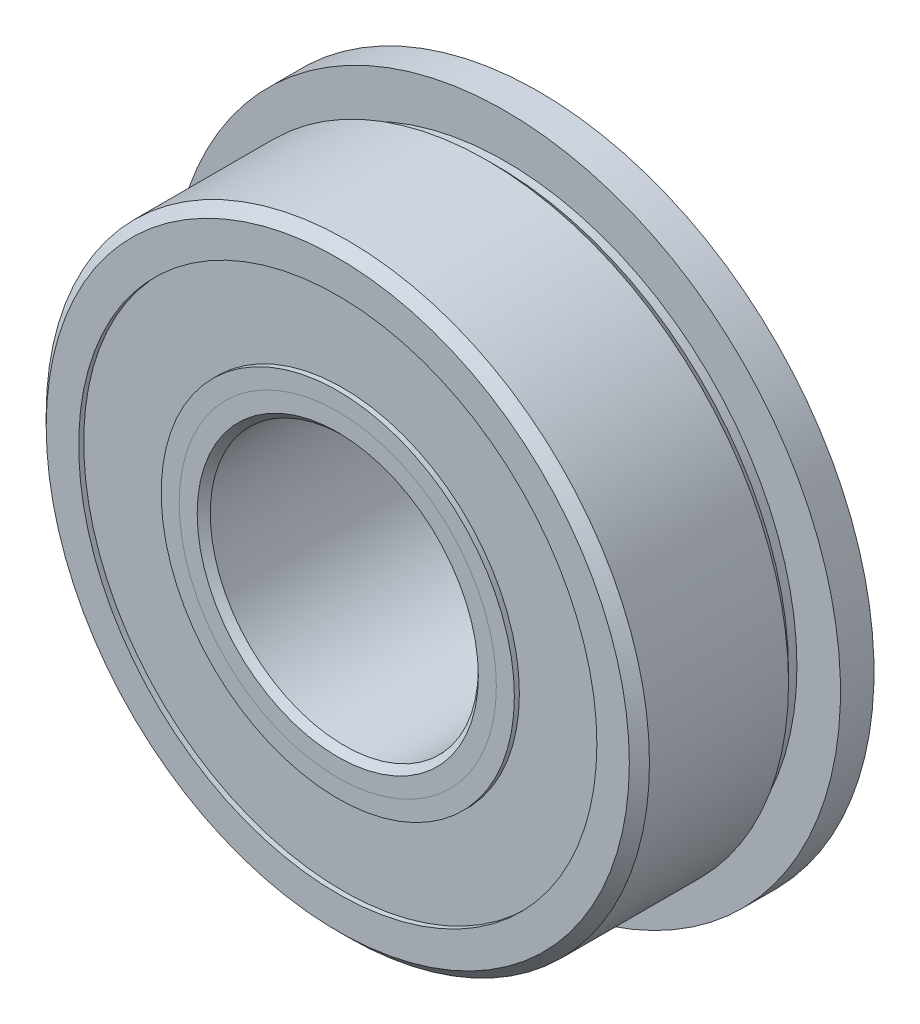
from build123d import *

# Parameters (mm, degrees)
SKETCH5_W          = 1.5875
SKETCH5_H          = 2.833076923
CIRPATTERN1_COUNT  = 12
SKETCH7_W          = 1.174197652
SKETCH7_H          = 3.907692308
SKETCH7_H_2        = 3.534996154
SKETCH9_R          = 7.956677
SKETCH9_R_2        = 7.607173
CUT_EXTRUDE1_DEPTH = 0.127
SKETCH10_R         = 9.436608
SKETCH10_R_2       = 8.7376
CUT_EXTRUDE2_DEPTH = 0.254


with BuildPart() as part:
    # Sketch8 → Revolve7 (revolve)
    with BuildSketch(Plane(origin=(0, 0, 0), x_dir=(0, 0, -1), z_dir=(1, 0, 0)), mode=Mode.PRIVATE) as revolve7_sk:
        with BuildLine():
            ThreePointArc((2.721428571, 12.272596154), (0, 13.668927348), (-2.721428571, 12.272596154))
            Line((-2.721428571, 12.272596154), (-4.7625, 12.272596154))
            Line((-4.7625, 12.272596154), (-4.7625, 13.81125))
            Line((-4.7625, 13.81125), (-4.28625, 14.2875))
            Line((-4.28625, 14.2875), (4.28625, 14.2875))
            Line((4.28625, 14.2875), (4.7625, 13.81125))
            Line((4.7625, 13.81125), (4.7625, 12.272596154))
            Line((4.7625, 12.272596154), (2.721428571, 12.272596154))
        make_face()
    revolve(revolve7_sk.sketch.rotate(Axis((0, 0, 4.7625), (0, 0, -1)), 90), axis=Axis((0, 0, 4.7625), (0, 0, -1)))

    # Sketch5 → Revolve5 (revolve)
    with BuildSketch(Plane(origin=(0, 0, 0), x_dir=(0, 0, -1), z_dir=(1, 0, 0)), mode=Mode.PRIVATE) as revolve5_sk:
        with Locations((3.96875, 14.458461539)):
            Rectangle(SKETCH5_W, SKETCH5_H)
    revolve(revolve5_sk.sketch.rotate(Axis((0, 0, -6.35), (0, 0, 1)), 270), axis=Axis((0, 0, -6.35), (0, 0, 1)))

    # Sketch6 → Cut-Revolve1 (revolve, cut)
    with BuildSketch(Plane(origin=(0, 0, 0), x_dir=(0, 0, -1), z_dir=(1, 0, 0)), mode=Mode.PRIVATE) as cut_revolve1_sk:
        Polygon((2.301875, 14.2875), (2.778125, 13.81125), (3.175, 13.81125), (3.175, 14.2875), align=None)
    revolve(cut_revolve1_sk.sketch.rotate(Axis((0, 0, 4.7625), (0, 0, -1)), 90), axis=Axis((0, 0, 4.7625), (0, 0, -1)), mode=Mode.SUBTRACT)


with BuildPart() as body_2:
    # Sketch2 → Revolve2 (revolve)
    with BuildSketch(Plane(origin=(0, 0, 0), x_dir=(0, 0, -1), z_dir=(1, 0, 0)), mode=Mode.PRIVATE) as revolve2_sk:
        with BuildLine():
            Line((-4.7625, 8.364903846), (-2.721428571, 8.364903846))
            ThreePointArc((-2.721428571, 8.364903846), (-1.529371952, 7.338026985), (0, 6.968572652))
            Line((0, 6.968572652), (0, 6.659286326))
            Line((0, 6.659286326), (-3.90969124, 6.659286326))
            Line((-3.90969124, 6.659286326), (-4.7625, 7.512095086))
            Line((-4.7625, 7.512095086), (-4.7625, 8.364903846))
        make_face()
    revolve(revolve2_sk.sketch.rotate(Axis((0, 0, 4.7625), (0, 0, -1)), 90), axis=Axis((0, 0, 4.7625), (0, 0, -1)))


with BuildPart() as body_3:
    # Sketch3 → Revolve3 (revolve)
    with BuildSketch(Plane(origin=(0, 0, 0), x_dir=(0, 0, -1), z_dir=(1, 0, 0)), mode=Mode.PRIVATE) as revolve3_sk:
        with BuildLine():
            Line((-4.7625, 7.512095086), (-3.90969124, 6.659286326))
            Line((-3.90969124, 6.659286326), (0, 6.659286326))
            Line((0, 6.659286326), (0, 6.968572652))
            ThreePointArc((0, 6.968572652), (1.721417345, 7.444656997), (2.953583068, 8.7376))
            Line((2.953583068, 8.7376), (6.35, 8.7376))
            Line((6.35, 8.7376), (6.35, 6.82625))
            Line((6.35, 6.82625), (5.87375, 6.35))
            Line((5.87375, 6.35), (-4.453213674, 6.35))
            Line((-4.453213674, 6.35), (-4.7625, 6.659286326))
            Line((-4.7625, 6.659286326), (-4.7625, 7.512095086))
        make_face()
    revolve(revolve3_sk.sketch.rotate(Axis((0, 0, 4.7625), (0, 0, -1)), 90), axis=Axis((0, 0, 4.7625), (0, 0, -1)))

    # Sketch9 → Cut-Extrude1 (cut)
    with BuildSketch(Plane(origin=(0, 0, -6.35), x_dir=(-1, 0, 0), z_dir=(0, 0, -1))):
        Circle(SKETCH9_R)
        Circle(SKETCH9_R_2, mode=Mode.SUBTRACT)
    extrude(amount=-CUT_EXTRUDE1_DEPTH, mode=Mode.SUBTRACT)


with BuildPart() as body_4:
    # Sketch4 → Revolve4 (revolve)
    with BuildSketch(Plane(origin=(0, 0, 0), x_dir=(0, 0, -1), z_dir=(1, 0, 0))):
        with BuildLine():
            Line((-3.350177348, 10.31875), (3.350177348, 10.31875))
            ThreePointArc((3.350177348, 10.31875), (0, 13.668927348), (-3.350177348, 10.31875))
        make_face()
    revolve(axis=Axis((0, 10.31875, 3.350177348), (0, 0, -1)))


with BuildPart() as cirpattern1_1:
    # CirPattern1: pattern copy
    add(body_4.part.rotate(Axis((0, 0, 0), (0, 0, 1)), 1 * 360 / CIRPATTERN1_COUNT))


with BuildPart() as cirpattern1_2:
    # CirPattern1: pattern copy
    add(body_4.part.rotate(Axis((0, 0, 0), (0, 0, 1)), 2 * 360 / CIRPATTERN1_COUNT))


with BuildPart() as cirpattern1_3:
    # CirPattern1: pattern copy
    add(body_4.part.rotate(Axis((0, 0, 0), (0, 0, 1)), 3 * 360 / CIRPATTERN1_COUNT))


with BuildPart() as cirpattern1_4:
    # CirPattern1: pattern copy
    add(body_4.part.rotate(Axis((0, 0, 0), (0, 0, 1)), 4 * 360 / CIRPATTERN1_COUNT))


with BuildPart() as cirpattern1_5:
    # CirPattern1: pattern copy
    add(body_4.part.rotate(Axis((0, 0, 0), (0, 0, 1)), 5 * 360 / CIRPATTERN1_COUNT))


with BuildPart() as cirpattern1_6:
    # CirPattern1: pattern copy
    add(body_4.part.rotate(Axis((0, 0, 0), (0, 0, 1)), 6 * 360 / CIRPATTERN1_COUNT))


with BuildPart() as cirpattern1_7:
    # CirPattern1: pattern copy
    add(body_4.part.rotate(Axis((0, 0, 0), (0, 0, 1)), 7 * 360 / CIRPATTERN1_COUNT))


with BuildPart() as cirpattern1_8:
    # CirPattern1: pattern copy
    add(body_4.part.rotate(Axis((0, 0, 0), (0, 0, 1)), 8 * 360 / CIRPATTERN1_COUNT))


with BuildPart() as cirpattern1_9:
    # CirPattern1: pattern copy
    add(body_4.part.rotate(Axis((0, 0, 0), (0, 0, 1)), 9 * 360 / CIRPATTERN1_COUNT))


with BuildPart() as cirpattern1_10:
    # CirPattern1: pattern copy
    add(body_4.part.rotate(Axis((0, 0, 0), (0, 0, 1)), 10 * 360 / CIRPATTERN1_COUNT))


with BuildPart() as cirpattern1_11:
    # CirPattern1: pattern copy
    add(body_4.part.rotate(Axis((0, 0, 0), (0, 0, 1)), 11 * 360 / CIRPATTERN1_COUNT))


with BuildPart() as body_16:
    # Sketch7 → Revolve6 (revolve)
    with BuildSketch(Plane(origin=(0, 0, 0), x_dir=(0, 0, -1), z_dir=(1, 0, 0)), mode=Mode.PRIVATE) as revolve6_sk:
        with Locations((-3.937276174, 10.31875)):
            Rectangle(SKETCH7_W, SKETCH7_H)
        with Locations((3.937276174, 10.505098077)):
            Rectangle(SKETCH7_W, SKETCH7_H_2)
    revolve(revolve6_sk.sketch.rotate(Axis((0, 0, 4.7625), (0, 0, -1)), 90), axis=Axis((0, 0, 4.7625), (0, 0, -1)))

    # Sketch10 → Cut-Extrude2 (cut)
    with BuildSketch(Plane(origin=(0, 0, -4.524375), x_dir=(-1, 0, 0), z_dir=(0, 0, -1))):
        Circle(SKETCH10_R)
        with Locations(Location((0, 0, 0), (0, 0, 180))):
            Circle(SKETCH10_R_2, mode=Mode.SUBTRACT)
    extrude(amount=-CUT_EXTRUDE2_DEPTH, mode=Mode.SUBTRACT)


solid = Compound([part.part, body_2.part, body_3.part, body_4.part, cirpattern1_1.part, cirpattern1_2.part, cirpattern1_3.part, cirpattern1_4.part, cirpattern1_5.part, cirpattern1_6.part, cirpattern1_7.part, cirpattern1_8.part, cirpattern1_9.part, cirpattern1_10.part, cirpattern1_11.part, body_16.part])
